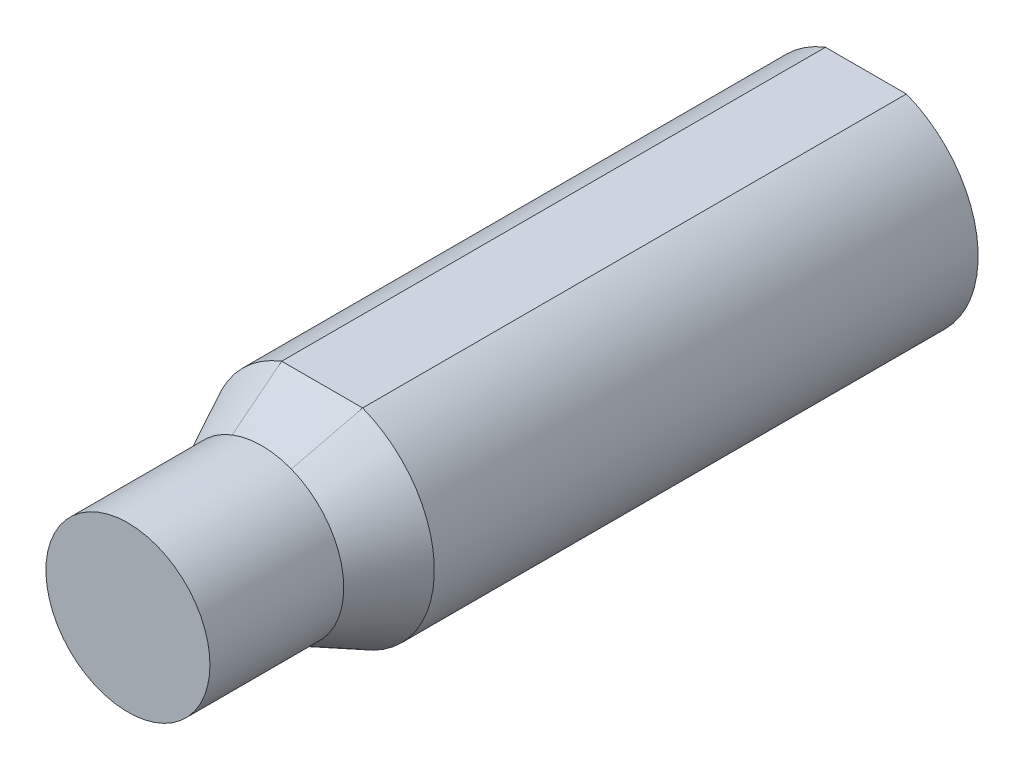
from build123d import *

# Parameters (mm, degrees)
BOSS_EXTRUDE1_DEPTH = 12.6
SKETCH2_R           = 1.9
BOSS_EXTRUDE2_DEPTH = 3.1


with BuildPart() as part:
    # Sketch1 → Boss-Extrude1 (new body)
    with BuildSketch(Plane.XY):
        with BuildLine():
            Line((-0.937749967, 2.425), (0.937749967, 2.425))
            ThreePointArc((0.937749967, 2.425), (2.6, 0), (0.937749967, -2.425))
            Line((0.937749967, -2.425), (-0.937749967, -2.425))
            ThreePointArc((-0.937749967, -2.425), (-2.6, 0), (-0.937749967, 2.425))
        make_face()
    extrude(amount=BOSS_EXTRUDE1_DEPTH)

    # Sketch2 → Loft1 section 0
    with BuildSketch(Plane.XY.offset(14)):
        Circle(SKETCH2_R)
    # Sketch3 → Loft1 section 1
    with BuildSketch(Plane.XY.offset(12.6)):
        with BuildLine():
            Line((-0.937749967, -2.425), (0.937749967, -2.425))
            ThreePointArc((0.937749967, -2.425), (2.6, 0), (0.937749967, 2.425))
            Line((0.937749967, 2.425), (-0.937749967, 2.425))
            ThreePointArc((-0.937749967, 2.425), (-2.6, 0), (-0.937749967, -2.425))
        make_face()
    loft()

    # Sketch4 → Boss-Extrude2 (add)
    with BuildSketch(Plane.XY.offset(14)):
        with BuildLine():
            ThreePointArc((0.685278822, 1.772115385), (0, 1.9), (-0.685278822, 1.772115385))
            ThreePointArc((-0.685278822, 1.772115385), (-1.9, 0), (-0.685278822, -1.772115385))
            ThreePointArc((-0.685278822, -1.772115385), (0, -1.9), (0.685278822, -1.772115385))
            ThreePointArc((0.685278822, -1.772115385), (1.9, 0), (0.685278822, 1.772115385))
        make_face()
    extrude(amount=BOSS_EXTRUDE2_DEPTH)


solid = part.part
